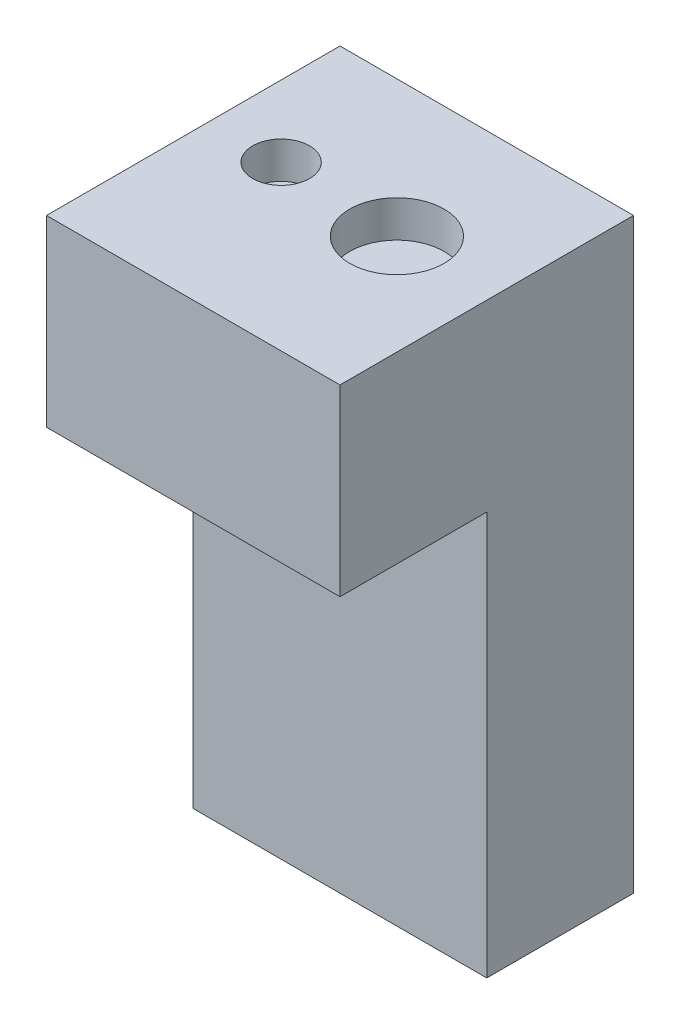
from build123d import *

# Parameters (mm, degrees)
SKETCH_1_W          = 40
SKETCH_1_H          = 80
EXTRUDE_1_DEPTH     = 20
SKETCH_2_W          = 40
SKETCH_2_H          = 25
EXTRUDE_2_DEPTH     = 20
SKETCH_3_R          = 3.87339884
SKETCH_3_R_2        = 6.424173687
CUT_EXTRUDE_1_DEPTH = 5


with BuildPart() as part:
    # 草图1 → 凸台-拉伸1 (new body)
    with BuildSketch(Plane.XY):
        Rectangle(SKETCH_1_W, SKETCH_1_H)
    extrude(amount=EXTRUDE_1_DEPTH)

    # 草图2 → 凸台-拉伸2 (add)
    with BuildSketch(Plane.XY.offset(20)):
        with Locations((0, 27.5)):
            Rectangle(SKETCH_2_W, SKETCH_2_H)
    extrude(amount=EXTRUDE_2_DEPTH)

    # 草图3 → 切除-拉伸1 (cut)
    with BuildSketch(Plane(origin=(0, 40, 0), x_dir=(1, 0, 0), z_dir=(0, 1, 0))):
        with Locations(Location((-10.297572527, -17.722901183, 0), (0, 0, 270))):
            Circle(SKETCH_3_R)
        with Locations(Location((6.329700544, -18.573159465, 0), (0, 0, 270))):
            Circle(SKETCH_3_R_2)
    extrude(amount=-CUT_EXTRUDE_1_DEPTH, mode=Mode.SUBTRACT)


solid = part.part
